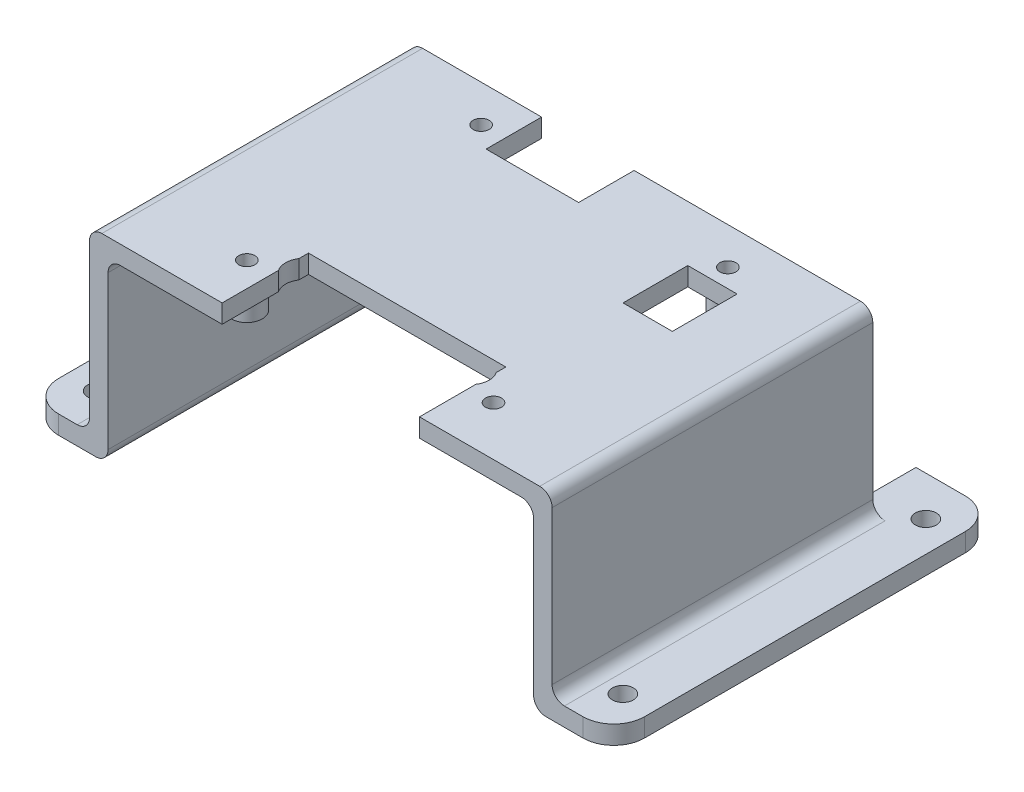
from build123d import *
from build123d.topology import SkipClean

# Parameters (mm, degrees)
SKETCH1_W           = 95
SKETCH1_H           = 62
SKETCH1_R           = 1.7
BOSS_EXTRUDE1_DEPTH = 3
SKETCH2_W           = 75
SKETCH2_H           = 52
BOSS_EXTRUDE2_DEPTH = 28.85
SKETCH3_W           = 69
SKETCH3_H           = 25.85
CUT_EXTRUDE1_DEPTH  = 118.827935991
SKETCH4_W           = 69
SKETCH4_H           = 3
CUT_EXTRUDE2_DEPTH  = 118.827935991
SKETCH5_R           = 1.3
SKETCH5_W           = 32
SKETCH5_H           = 14
CUT_EXTRUDE3_DEPTH  = 118.827935991
SKETCH7_R           = 3
CUT_EXTRUDE5_DEPTH  = 118.827935991
SKETCH6_W           = 15
SKETCH6_H           = 9
SKETCH6_W_2         = 8
SKETCH6_H_2         = 10.5
CUT_EXTRUDE4_DEPTH  = 118.827935991
FILLET1_R           = 2
SKETCH8_R           = 2.5
SKETCH8_R_2         = 1.3
BOSS_EXTRUDE4_DEPTH = 4
FILLET2_R           = 5


with BuildPart() as part:
    # Sketch1 → Boss-Extrude1 (new body)
    with BuildSketch(Plane(origin=(0, 0, 0), x_dir=(1, 0, 0), z_dir=(0, 1, 0))):
        with Locations((47.5, 31)):
            Rectangle(SKETCH1_W, SKETCH1_H)
        with Locations(Location((90.04349796, 55.565, 0), (0, 0, 270))):
            Circle(SKETCH1_R, mode=Mode.SUBTRACT)
        with Locations(Location((90.04349796, 6.435, 0), (0, 0, 270))):
            Circle(SKETCH1_R, mode=Mode.SUBTRACT)
        with Locations(Location((4.95650204, 55.565, 0), (0, 0, 270))):
            Circle(SKETCH1_R, mode=Mode.SUBTRACT)
        with Locations(Location((4.95650204, 6.435, 0), (0, 0, 270))):
            Circle(SKETCH1_R, mode=Mode.SUBTRACT)
    extrude(amount=BOSS_EXTRUDE1_DEPTH)

    # Sketch2 → Boss-Extrude2 (add)
    with BuildSketch(Plane(origin=(0, 3, 0), x_dir=(1, 0, 0), z_dir=(0, 1, 0))):
        with Locations((47.5, 26)):
            Rectangle(SKETCH2_W, SKETCH2_H)
    extrude(amount=BOSS_EXTRUDE2_DEPTH)

    # Sketch3 → Cut-Extrude1 (cut, through all)
    with BuildSketch(Plane.XY):
        with Locations((47.5, 15.925)):
            Rectangle(SKETCH3_W, SKETCH3_H)
    extrude(amount=-CUT_EXTRUDE1_DEPTH, mode=Mode.SUBTRACT)

    # Sketch4 → Cut-Extrude2 (cut, through all)
    with BuildSketch(Plane.XY):
        with Locations((47.5, 1.5)):
            Rectangle(SKETCH4_W, SKETCH4_H)
    extrude(amount=-CUT_EXTRUDE2_DEPTH, mode=Mode.SUBTRACT)

    # Sketch5 → Cut-Extrude3 (cut, through all)
    with BuildSketch(Plane(origin=(0, 31.85, 0), x_dir=(1, 0, 0), z_dir=(0, 1, 0))):
        with Locations(Location((27.5, 46, 0), (0, 0, 270))):
            Circle(SKETCH5_R)
        with Locations(Location((27.5, 8, 0), (0, 0, 270))):
            Circle(SKETCH5_R)
        with Locations(Location((67.5, 8, 0), (0, 0, 270))):
            Circle(SKETCH5_R)
        with Locations(Location((67.5, 46, 0), (0, 0, 270))):
            Circle(SKETCH5_R)
        with Locations((47.5, 7)):
            Rectangle(SKETCH5_W, SKETCH5_H)
    extrude(amount=-CUT_EXTRUDE3_DEPTH, mode=Mode.SUBTRACT)

    # Sketch7 → Cut-Extrude5 (cut, through all)
    with BuildSketch(Plane(origin=(0, 31.85, 0), x_dir=(1, 0, 0), z_dir=(0, 1, 0))):
        with Locations((34, 10.8)):
            Circle(SKETCH7_R)
        with Locations((61, 10.8)):
            Circle(SKETCH7_R)
    extrude(amount=-CUT_EXTRUDE5_DEPTH, mode=Mode.SUBTRACT)

    # Sketch6 → Cut-Extrude4 (cut, through all)
    with BuildSketch(Plane(origin=(0, 31.85, 0), x_dir=(1, 0, 0), z_dir=(0, 1, 0))):
        with Locations((38.8, 47.5)):
            Rectangle(SKETCH6_W, SKETCH6_H)
        with Locations((68, 37.75)):
            Rectangle(SKETCH6_W_2, SKETCH6_H_2)
    extrude(amount=-CUT_EXTRUDE4_DEPTH, mode=Mode.SUBTRACT)

    # Fillet1
    fillet1_edges = [part.edges().sort_by_distance(p)[0] for p in [
        (10, 3, -26),
        (85, 3, -26),
        (10, 31.85, -26),
        (85, 31.85, -26),
        (13, 28.85, -26),
        (82, 28.85, -26),
        (13, 0, -31),
        (82, 0, -31),
    ]]
    fillet(fillet1_edges, radius=FILLET1_R)

    # Sketch8 → Boss-Extrude4 (add)
    # profile 1 of 4: a face of its own
    with SkipClean():  # the faces are left unmerged after this step: merging them gives an invalid solid
        with BuildSketch(Plane.XZ.offset(-28.85)):
            with Locations(Location((27.5, -8, 0), (0, 0, 90))):
                Circle(SKETCH8_R)
            with Locations(Location((27.5, -8, 0), (0, 0, 90))):
                Circle(SKETCH8_R_2, mode=Mode.SUBTRACT)
        # profile 2 of 4: a face of its own
        with BuildSketch(Plane.XZ.offset(-28.85)):
            with Locations(Location((67.5, -8, 0), (0, 0, 90))):
                Circle(SKETCH8_R)
            with Locations(Location((67.5, -8, 0), (0, 0, 270))):
                Circle(SKETCH8_R_2, mode=Mode.SUBTRACT)
        # profile 3 of 4: a face of its own
        with BuildSketch(Plane.XZ.offset(-28.85)):
            with Locations(Location((27.5, -46, 0), (0, 0, 90))):
                Circle(SKETCH8_R)
            with Locations(Location((27.5, -46, 0), (0, 0, 90))):
                Circle(SKETCH8_R_2, mode=Mode.SUBTRACT)
        # profile 4 of 4: a face of its own
        with BuildSketch(Plane.XZ.offset(-28.85)):
            with Locations(Location((67.5, -46, 0), (0, 0, 90))):
                Circle(SKETCH8_R)
            with Locations(Location((67.5, -46, 0), (0, 0, 270))):
                Circle(SKETCH8_R_2, mode=Mode.SUBTRACT)
        extrude(amount=BOSS_EXTRUDE4_DEPTH)

    # Fillet2
    fillet2_edges = [part.edges().sort_by_distance(p)[0] for p in [
        (0, 1.5, -62),
        (95, 1.5, -62),
        (95, 1.5, 0),
        (0, 1.5, 0),
    ]]
    fillet(fillet2_edges, radius=FILLET2_R)


solid = part.part
